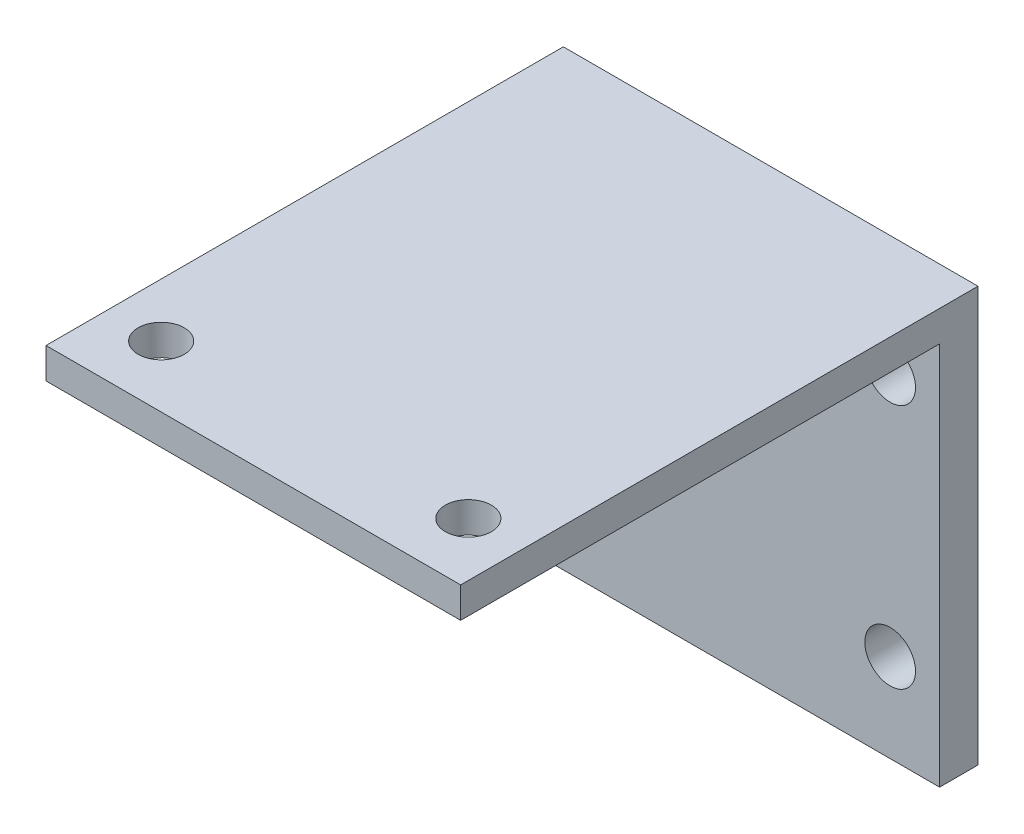
from build123d import *

# Parameters (mm, degrees)
ESQUISSE1_W             = 54
ESQUISSE1_H             = 54
BOSS_EXTRU_1_DEPTH      = 67.37
ESQUISSE2_W             = 85.887974464
ESQUISSE2_H             = 58.790343592
ENL_V_MAT_EXTRU_1_DEPTH = 62.37
ESQUISSE3_R             = 3
ENL_V_MAT_EXTRU_2_DEPTH = 62.37
D_GAGEMENT_M61_D        = 6.6


with BuildPart() as part:
    # Esquisse1 → Boss.-Extru.1 (new body)
    with BuildSketch(Plane.XY):
        Rectangle(ESQUISSE1_W, ESQUISSE1_H)
    extrude(amount=BOSS_EXTRU_1_DEPTH)

    # Esquisse2 → Enlèv. mat.-Extru.1 (cut)
    with BuildSketch(Plane.XY.offset(67.37)):
        with Locations((-4.168944697, -6.395171796)):
            Rectangle(ESQUISSE2_W, ESQUISSE2_H)
    extrude(amount=-ENL_V_MAT_EXTRU_1_DEPTH, mode=Mode.SUBTRACT)

    # Esquisse3 → Enlèv. mat.-Extru.2 (cut)
    with BuildSketch(Plane.XZ.offset(-23)):
        with Locations(Location((-20, 59.37, 0), (0, 0, 270))):
            Circle(ESQUISSE3_R)
        with Locations(Location((20, 59.37, 0), (0, 0, 270))):
            Circle(ESQUISSE3_R)
    extrude(amount=-ENL_V_MAT_EXTRU_2_DEPTH, mode=Mode.SUBTRACT)

    # Dégagement M61 (through all)
    with Locations(Plane(origin=(0, 0, 0), x_dir=(-1, 0, 0), z_dir=(0, 0, -1))):
        with Locations((-20.562817304, -15.5), (-20.562817304, 16.5)):
            Hole(D_GAGEMENT_M61_D / 2)


solid = part.part
